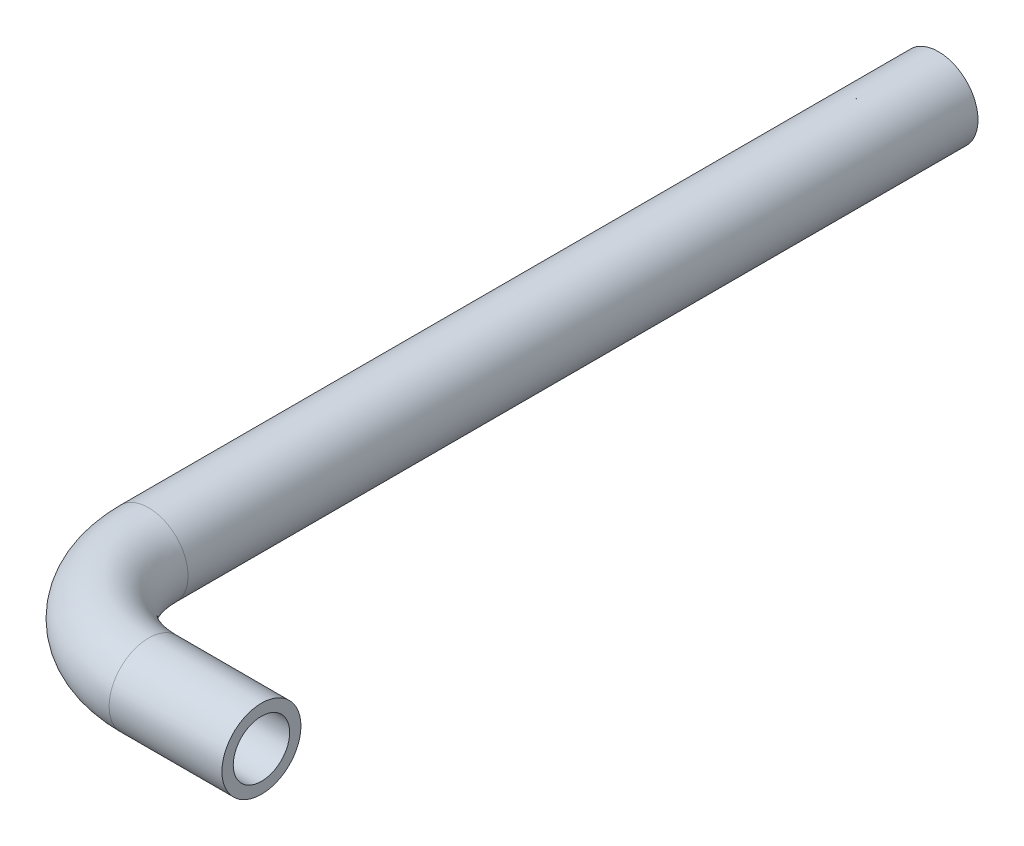
from build123d import *

# Parameters (mm, degrees)
SKETCH_1_R                      = 17.5
SKETCH_1_R_2                    = 12.5
CUT_EXTRUDE_3_REACH             = 483.521
SKETCH_3_R                      = 17.5
SKETCH_3_R_2                    = 12.5
CUT_EXTRUDE_3_DIRECTION_2_DEPTH = 150


with BuildPart() as part:
    # 扫描1: sweep along a path in 草图2
    with BuildLine(Plane(origin=(0, 0, 0), x_dir=(1, 0, 0), z_dir=(0, 1, 0))) as sweep_1_path:
        Line((0, 0), (-450, 0))
        ThreePointArc((-450, 0), (-485.355339059, 14.644660941), (-500, 50))
        Line((-500, 50), (-500, 400))
    # 草图1 → 扫描1 (sweep)
    with BuildSketch(Plane(origin=(0, 0, 0), x_dir=(0, 0, -1), z_dir=(1, 0, 0))):
        Circle(SKETCH_1_R)
        Circle(SKETCH_1_R_2, mode=Mode.SUBTRACT)
    sweep(path=sweep_1_path.line)

    # 草图3 → 切除-拉伸3 (cut, up to next)
    with BuildSketch(Plane(origin=(-250, 0, 0), x_dir=(0, 0, -1), z_dir=(1, 0, 0)), mode=Mode.PRIVATE) as cut_extrude_3_sk1:
        Circle(SKETCH_3_R)
        Circle(SKETCH_3_R_2, mode=Mode.SUBTRACT)
    cut_extrude_3_tool1 = extrude(cut_extrude_3_sk1.sketch, amount=CUT_EXTRUDE_3_REACH, mode=Mode.PRIVATE) & part.part
    add(cut_extrude_3_tool1.solids().sort_by_distance((-250, 0, 17.005025))[0], mode=Mode.SUBTRACT)

    # 草图3 → 切除-拉伸3 direction 2 (cut)
    with BuildSketch(Plane(origin=(-250, 0, 0), x_dir=(0, 0, -1), z_dir=(1, 0, 0))):
        Circle(SKETCH_3_R)
        Circle(SKETCH_3_R_2, mode=Mode.SUBTRACT)
    extrude(amount=-CUT_EXTRUDE_3_DIRECTION_2_DEPTH, mode=Mode.SUBTRACT)


solid = part.part
